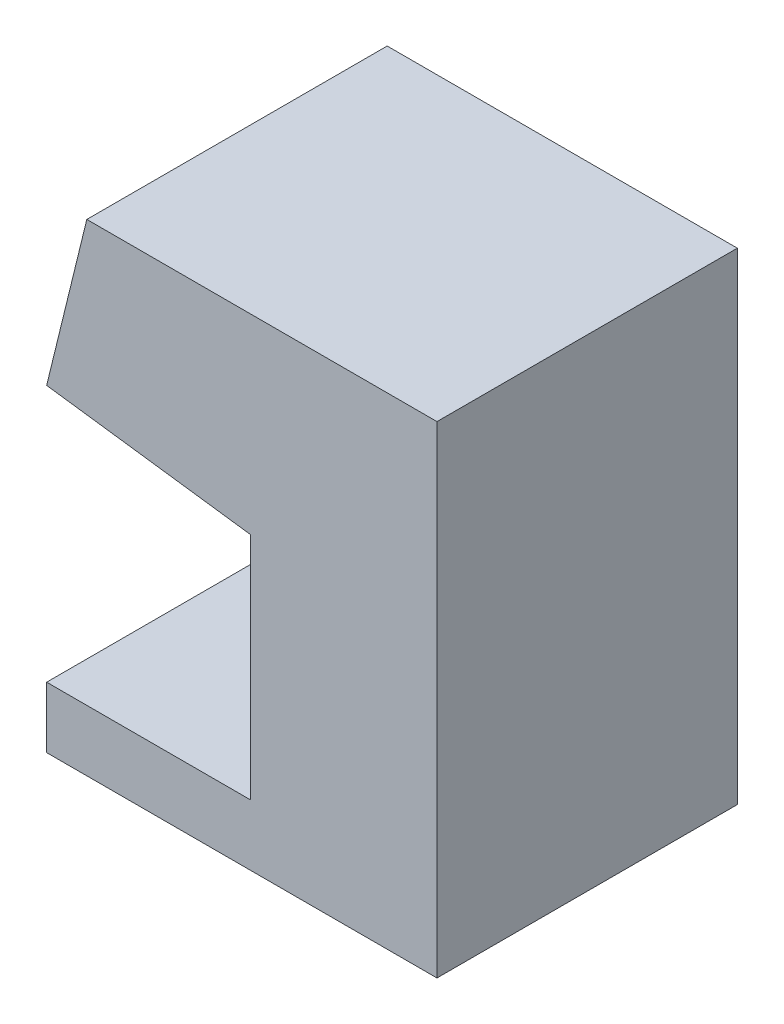
from build123d import *

# Parameters (mm, degrees)
BOSS_EXTRUDE2_DEPTH = 187


with BuildPart() as part:
    # Sketch1 → Boss-Extrude2 (new body)
    with BuildSketch(Plane.XY):
        Polygon((0, 0), (243, 0), (243, 300), (25, 300), (0, 198), (127, 181), (127, 38), (0, 38), align=None)
    extrude(amount=BOSS_EXTRUDE2_DEPTH)


solid = part.part
